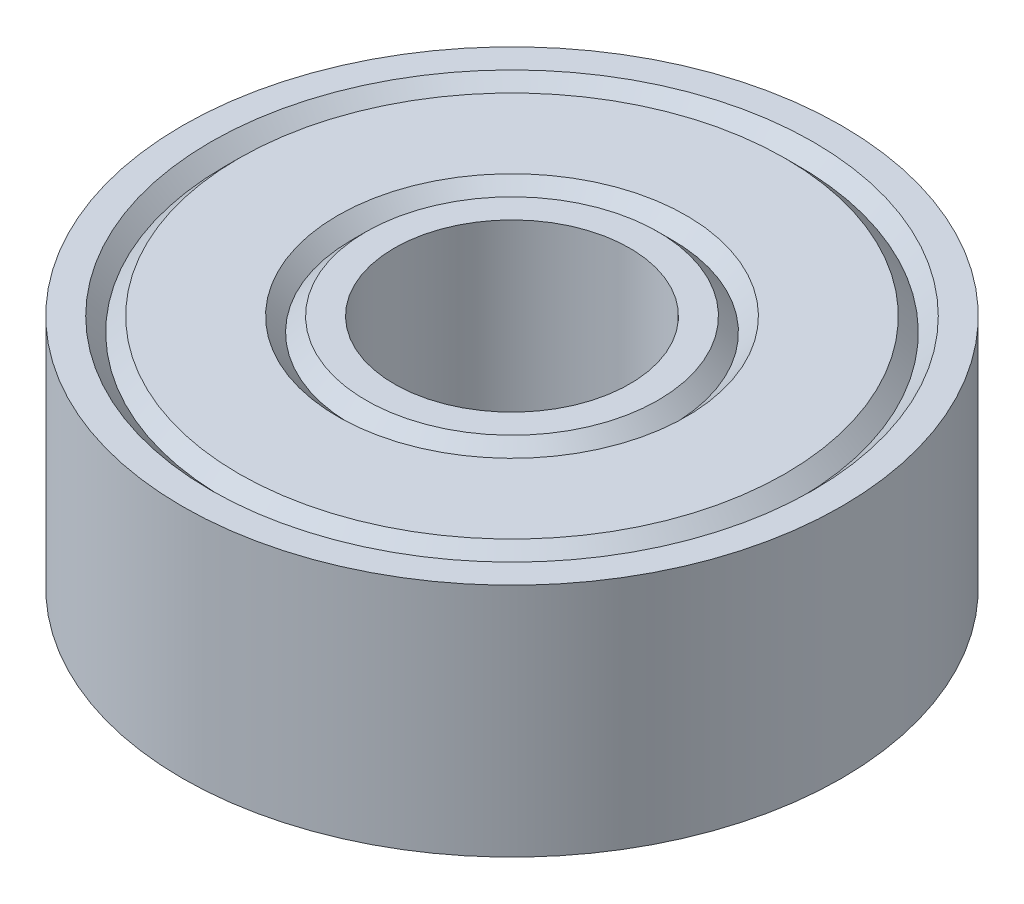
from build123d import *


with BuildPart() as part:
    # Sketch1 → Revolve1 (revolve)
    with BuildSketch(Plane.XY):
        Polygon((-2.5, 2.5), (-3.1, 2.5), (-3.4, 2.2), (-3.7, 2.5), (-5.8, 2.5), (-6.1, 2.2), (-6.4, 2.5), (-7, 2.5), (-7, -2.5), (-6.4, -2.5), (-6.1, -2.2), (-5.8, -2.5), (-3.7, -2.5), (-3.4, -2.2), (-3.1, -2.5), (-2.5, -2.5), align=None)
    revolve(axis=Axis((0, 2.5, 0), (0, -1, 0)))


solid = part.part
